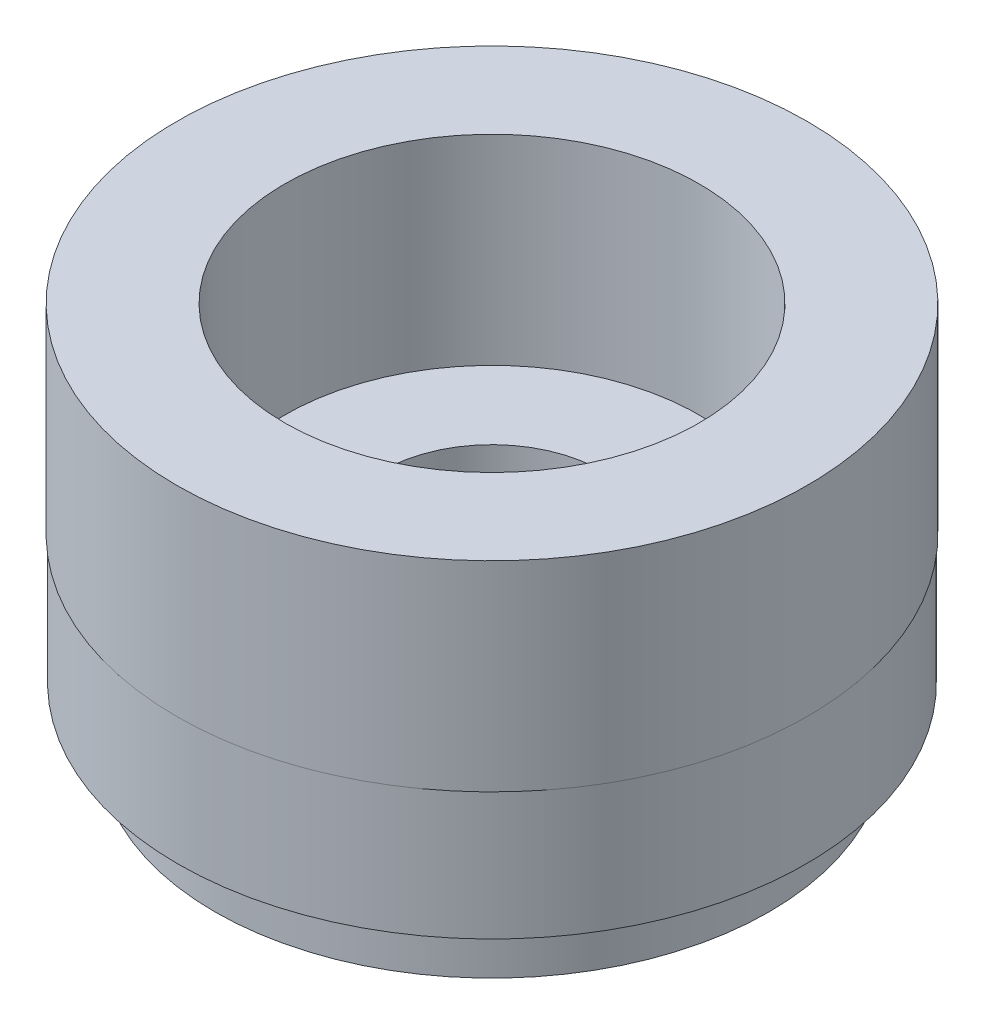
from build123d import *

# Parameters (mm, degrees)
SKETCH1_R           = 3.9878
BOSS_EXTRUDE1_DEPTH = 1.6256
SKETCH2_R           = 4.0005
BOSS_EXTRUDE2_DEPTH = 2.54
SKETCH3_R           = 3.5179
BOSS_EXTRUDE3_DEPTH = 0.762
SKETCH4_R           = 3.0099
CUT_EXTRUDE1_DEPTH  = 0.762
SKETCH5_R           = 2.6289
CUT_EXTRUDE2_DEPTH  = 2.54
SKETCH6_R           = 1.397
CUT_EXTRUDE3_DEPTH  = 7.201580484


with BuildPart() as part:
    # Sketch1 → Boss-Extrude1 (new body)
    with BuildSketch(Plane(origin=(0, 0, 0), x_dir=(1, 0, 0), z_dir=(0, 1, 0))):
        with Locations(Location((0, 0, 0), (0, 0, 270))):
            Circle(SKETCH1_R)
    extrude(amount=BOSS_EXTRUDE1_DEPTH)

    # Sketch2 → Boss-Extrude2 (add)
    with BuildSketch(Plane(origin=(0, 1.6256, 0), x_dir=(1, 0, 0), z_dir=(0, 1, 0))):
        with Locations(Location((0, 0, 0), (0, 0, 270))):
            Circle(SKETCH2_R)
    extrude(amount=BOSS_EXTRUDE2_DEPTH)

    # Sketch3 → Boss-Extrude3 (add)
    with BuildSketch(Plane.XZ):
        with Locations(Location((0, 0, 0), (0, 0, 90))):
            Circle(SKETCH3_R)
    extrude(amount=BOSS_EXTRUDE3_DEPTH)

    # Sketch4 → Cut-Extrude1 (cut)
    with BuildSketch(Plane.XZ.offset(0.762)):
        with Locations(Location((0, 0, 0), (0, 0, 270))):
            Circle(SKETCH4_R)
    extrude(amount=-CUT_EXTRUDE1_DEPTH, mode=Mode.SUBTRACT)

    # Sketch5 → Cut-Extrude2 (cut)
    with BuildSketch(Plane(origin=(0, 4.1656, 0), x_dir=(1, 0, 0), z_dir=(0, 1, 0))):
        with Locations(Location((0, 0, 0), (0, 0, 270))):
            Circle(SKETCH5_R)
    extrude(amount=-CUT_EXTRUDE2_DEPTH, mode=Mode.SUBTRACT)

    # Sketch6 → Cut-Extrude3 (cut, through all)
    with BuildSketch(Plane(origin=(0, 1.6256, 0), x_dir=(1, 0, 0), z_dir=(0, 1, 0))):
        with Locations(Location((0, 0, 0), (0, 0, 270))):
            Circle(SKETCH6_R)
    extrude(amount=-CUT_EXTRUDE3_DEPTH, mode=Mode.SUBTRACT)


solid = part.part
